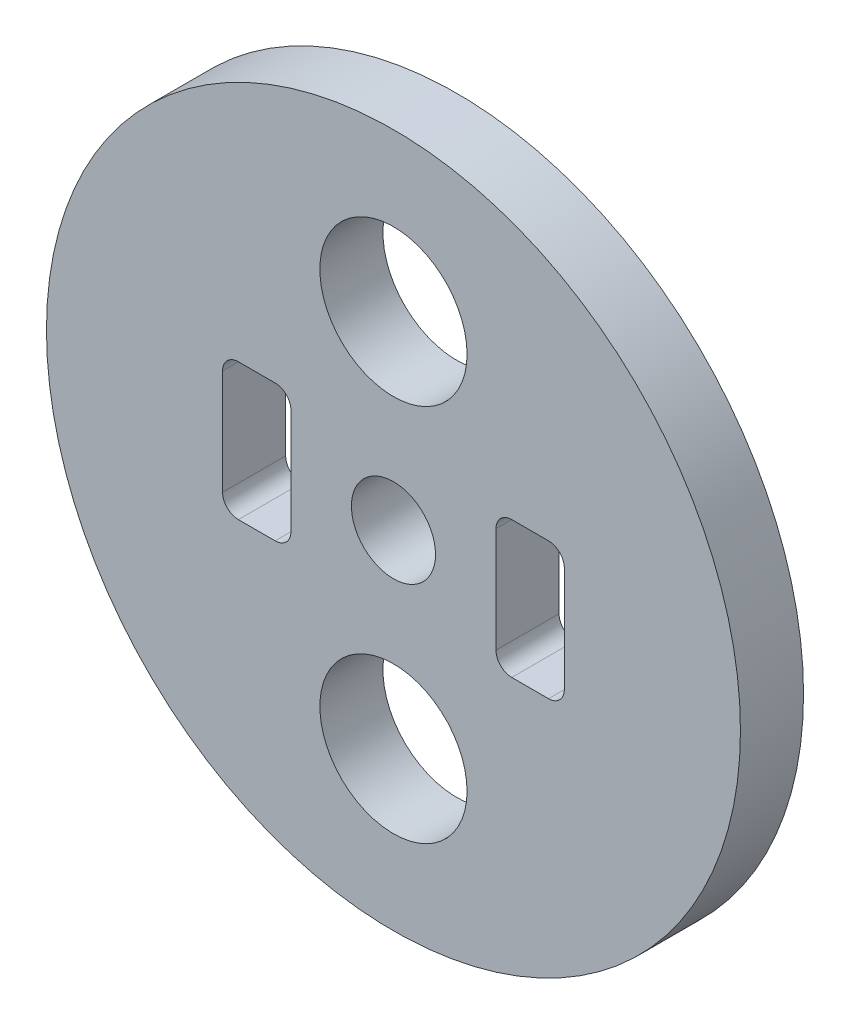
from build123d import *

# Parameters (mm, degrees)
MODEL_R                 = 16.5
MODEL_R_2               = 3.5
MODEL_R_3               = 2
SALIENTE_EXTRUIR1_DEPTH = 3


with BuildPart() as part:
    # Model → Saliente-Extruir1 (new body)
    with BuildSketch(Plane.XY):
        with Locations((215.747807914, 241.952019993)):
            Circle(MODEL_R)
        with BuildLine():
            ThreePointArc((207.622807913, 244.452019993), (207.842477828, 244.982350079), (208.372807913, 245.202019993))
            Line((208.372807913, 245.202019993), (210.122807913, 245.202019993))
            ThreePointArc((210.122807913, 245.202019993), (210.653137999, 244.982350079), (210.872807913, 244.452019993))
            Line((210.872807913, 244.452019993), (210.872807913, 239.452019993))
            ThreePointArc((210.872807914, 239.452019993), (210.653137999, 238.921689907), (210.122807913, 238.702019993))
            Line((210.122807913, 238.702019993), (208.372807913, 238.702019993))
            ThreePointArc((208.372807913, 238.702019993), (207.842477828, 238.921689907), (207.622807913, 239.452019993))
            Line((207.622807913, 239.452019993), (207.622807913, 244.452019993))
        make_face(mode=Mode.SUBTRACT)
        with Locations((215.747807914, 232.952019993)):
            Circle(MODEL_R_2, mode=Mode.SUBTRACT)
        with BuildLine():
            Line((221.372807913, 245.202019993), (223.122807913, 245.202019993))
            ThreePointArc((223.122807913, 245.202019993), (223.653137999, 244.982350079), (223.872807913, 244.452019993))
            Line((223.872807913, 244.452019993), (223.872807913, 239.452019993))
            ThreePointArc((223.872807914, 239.452019993), (223.653137999, 238.921689907), (223.122807913, 238.702019993))
            Line((223.122807913, 238.702019993), (221.372807913, 238.702019993))
            ThreePointArc((221.372807913, 238.702019993), (220.842477828, 238.921689907), (220.622807913, 239.452019993))
            Line((220.622807913, 239.452019993), (220.622807913, 244.452019993))
            ThreePointArc((220.622807913, 244.452019993), (220.842477828, 244.982350079), (221.372807913, 245.202019993))
        make_face(mode=Mode.SUBTRACT)
        with Locations((215.747807914, 241.952019993)):
            Circle(MODEL_R_3, mode=Mode.SUBTRACT)
        with Locations((215.747807914, 250.952019993)):
            Circle(MODEL_R_2, mode=Mode.SUBTRACT)
    extrude(amount=SALIENTE_EXTRUIR1_DEPTH)


solid = part.part
